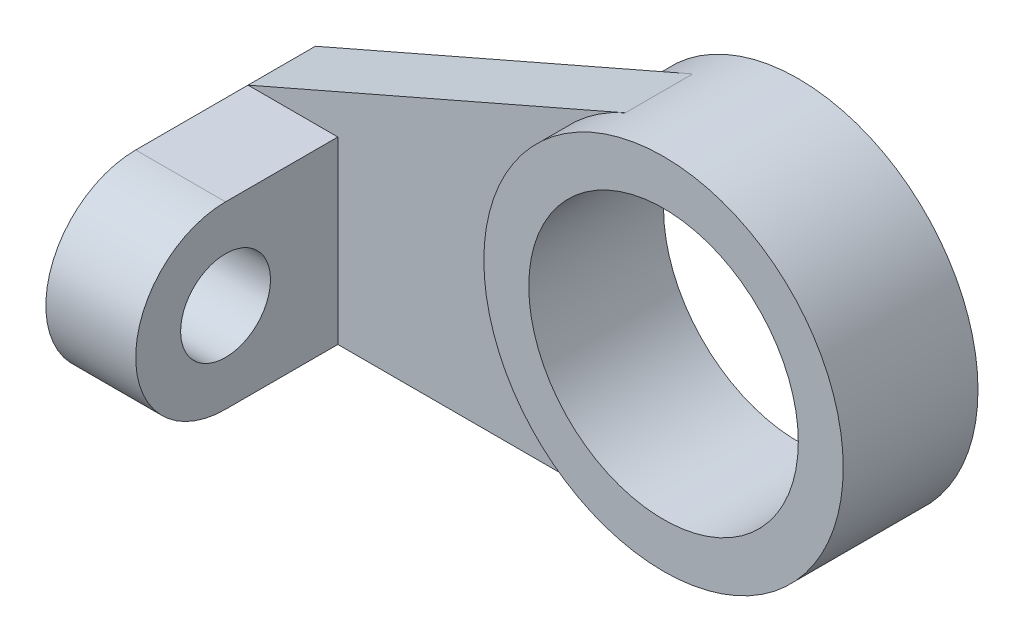
from build123d import *

# Parameters (mm, degrees)
SKETCH1_R           = 50.8
SKETCH1_R_2         = 38.1
BOSS_EXTRUDE1_DEPTH = 19.05
BOSS_EXTRUDE2_DEPTH = 9.525
SKETCH3_W           = 25.4
SKETCH3_H           = 50.8
BOSS_EXTRUDE3_DEPTH = 31.75
SKETCH4_R           = 25.4
SKETCH4_R_2         = 12.7
BOSS_EXTRUDE5_DEPTH = 25.4
SKETCH5_R           = 12.7
CUT_EXTRUDE1_DEPTH  = 197.56814499


with BuildPart() as part:
    # Sketch1 → Boss-Extrude1 (new, symmetric)
    with BuildSketch(Plane.XY):
        with Locations(Location((0, 0, 0), (0, 0, 180))):
            Circle(SKETCH1_R)
        with Locations(Location((0, 0, 0), (0, 0, 180))):
            Circle(SKETCH1_R_2, mode=Mode.SUBTRACT)
    extrude(amount=BOSS_EXTRUDE1_DEPTH, both=True)

    # Sketch2 → Boss-Extrude2 (add, symmetric)
    with BuildSketch(Plane.XY):
        with BuildLine():
            Line((0, -50.8), (-127, -50.8))
            Line((-127, -50.8), (-127, 0))
            Line((-127, 0), (-20.32, 46.558969061))
            ThreePointArc((-20.32, 46.558969061), (-49.728440697, -10.378929899), (0, -50.8))
        make_face()
    extrude(amount=BOSS_EXTRUDE2_DEPTH, both=True)

    # Sketch3 → Boss-Extrude3 (add)
    with BuildSketch(Plane.XY.offset(9.525)):
        with Locations((-114.3, -25.4)):
            Rectangle(SKETCH3_W, SKETCH3_H)
    extrude(amount=BOSS_EXTRUDE3_DEPTH)

    # Sketch4 → Boss-Extrude5 (add)
    with BuildSketch(Plane.ZY.offset(127)):
        with Locations((41.275, -25.4)):
            Circle(SKETCH4_R)
        with Locations((41.275, -25.4)):
            Circle(SKETCH4_R_2, mode=Mode.SUBTRACT)
    extrude(amount=-BOSS_EXTRUDE5_DEPTH)

    # Sketch5 → Cut-Extrude1 (cut, through all)
    with BuildSketch(Plane.ZY.offset(127)):
        with Locations((41.275, -25.4)):
            Circle(SKETCH5_R)
    extrude(amount=-CUT_EXTRUDE1_DEPTH, mode=Mode.SUBTRACT)


solid = part.part
